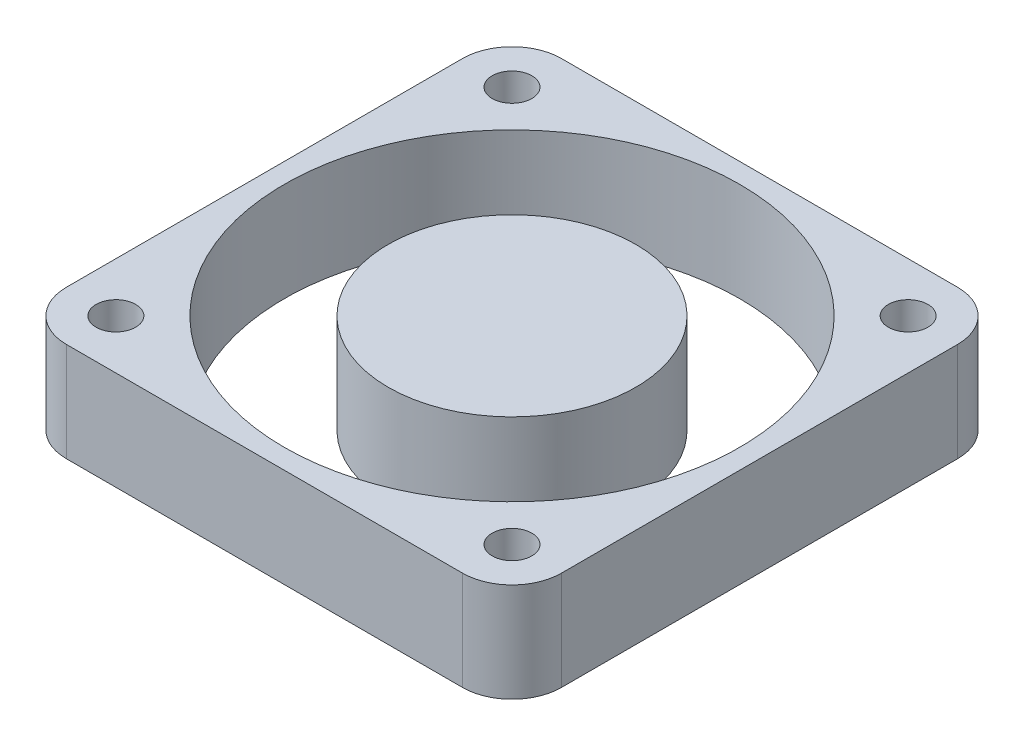
from build123d import *

# Parameters (mm, degrees)
EXTRUDE_1_DEPTH     = 10
SKETCH_2_R          = 12.5
CUT_EXTRUDE_1_DEPTH = 17
SKETCH_3_R          = 23
EXTRUDE_3_DEPTH     = 10
SKETCH_4_R          = 2
CUT_EXTRUDE_2_DEPTH = 10


with BuildPart() as part:
    # 草图1 → 拉伸1 (new body)
    with BuildSketch(Plane(origin=(0, 0, 0), x_dir=(1, 0, 0), z_dir=(0, 1, 0))):
        with BuildLine():
            Line((-20, 25), (20, 25))
            ThreePointArc((20, 25), (23.535533906, 23.535533906), (25, 20))
            Line((25, 20), (25, -20))
            ThreePointArc((25, -20), (23.535533906, -23.535533906), (20, -25))
            Line((20, -25), (-20, -25))
            ThreePointArc((-20, -25), (-23.535533906, -23.535533906), (-25, -20))
            Line((-25, -20), (-25, 20))
            ThreePointArc((-25, 20), (-23.535533906, 23.535533906), (-20, 25))
        make_face()
    extrude(amount=EXTRUDE_1_DEPTH)

    # 草图2 → 切除-拉伸1 (cut)
    with BuildSketch(Plane(origin=(0, 10, 0), x_dir=(-1, 0, 0), z_dir=(0, 1, 0))):
        with BuildLine():
            Line((-20, -23), (20, -23))
            ThreePointArc((20, -23), (22.121320344, -22.121320344), (23, -20))
            Line((23, -20), (23, 20))
            ThreePointArc((23, 20), (22.121320344, 22.121320344), (20, 23))
            Line((20, 23), (-20, 23))
            ThreePointArc((-20, 23), (-22.121320344, 22.121320344), (-23, 20))
            Line((-23, 20), (-23, -20))
            ThreePointArc((-23, -20), (-22.121320344, -22.121320344), (-20, -23))
        make_face()
        with Locations(Location((0, 0, 0), (0, 0, 90))):
            Circle(SKETCH_2_R, mode=Mode.SUBTRACT)
    extrude(amount=-CUT_EXTRUDE_1_DEPTH, mode=Mode.SUBTRACT)


with BuildPart() as cut_extrude_1_piece_1:
    # of the separate pieces the step leaves, piece 1, a body of its own (cut_extrude_1_pieces)
    add(part.part.solids().sort_by_distance((0, 0, 12.5))[0])


with BuildPart() as cut_extrude_1_piece_2:
    # of the separate pieces the step leaves, piece 2, a body of its own (cut_extrude_1_pieces)
    add(part.part.solids().sort_by_distance((-20, 0, -25))[0])

    # 草图3 → 拉伸3 (add)
    with BuildSketch(Plane(origin=(0, 10, 0), x_dir=(-1, 0, 0), z_dir=(0, 1, 0))):
        with BuildLine():
            Line((25, -20), (25, 20))
            ThreePointArc((25, 20), (23.535533906, 23.535533906), (20, 25))
            Line((20, 25), (-20, 25))
            ThreePointArc((-20, 25), (-23.535533906, 23.535533906), (-25, 20))
            Line((-25, 20), (-25, -20))
            ThreePointArc((-25, -20), (-23.535533906, -23.535533906), (-20, -25))
            Line((-20, -25), (20, -25))
            ThreePointArc((20, -25), (23.535533906, -23.535533906), (25, -20))
        make_face()
        with Locations(Location((0, 0, 0), (0, 0, 90))):
            Circle(SKETCH_3_R, mode=Mode.SUBTRACT)
    extrude(amount=-EXTRUDE_3_DEPTH)

    # 草图4 → 切除-拉伸2 (cut)
    with BuildSketch(Plane(origin=(0, 10, 0), x_dir=(-1, 0, 0), z_dir=(0, 1, 0))):
        with Locations(Location((-20, -20, 0), (0, 0, 90))):
            Circle(SKETCH_4_R)
        with Locations(Location((-20, 20, 0), (0, 0, 90))):
            Circle(SKETCH_4_R)
        with Locations(Location((20, 20, 0), (0, 0, 90))):
            Circle(SKETCH_4_R)
        with Locations(Location((20, -20, 0), (0, 0, 90))):
            Circle(SKETCH_4_R)
    extrude(amount=-CUT_EXTRUDE_2_DEPTH, mode=Mode.SUBTRACT)


solid = Compound([cut_extrude_1_piece_1.part, cut_extrude_1_piece_2.part])
